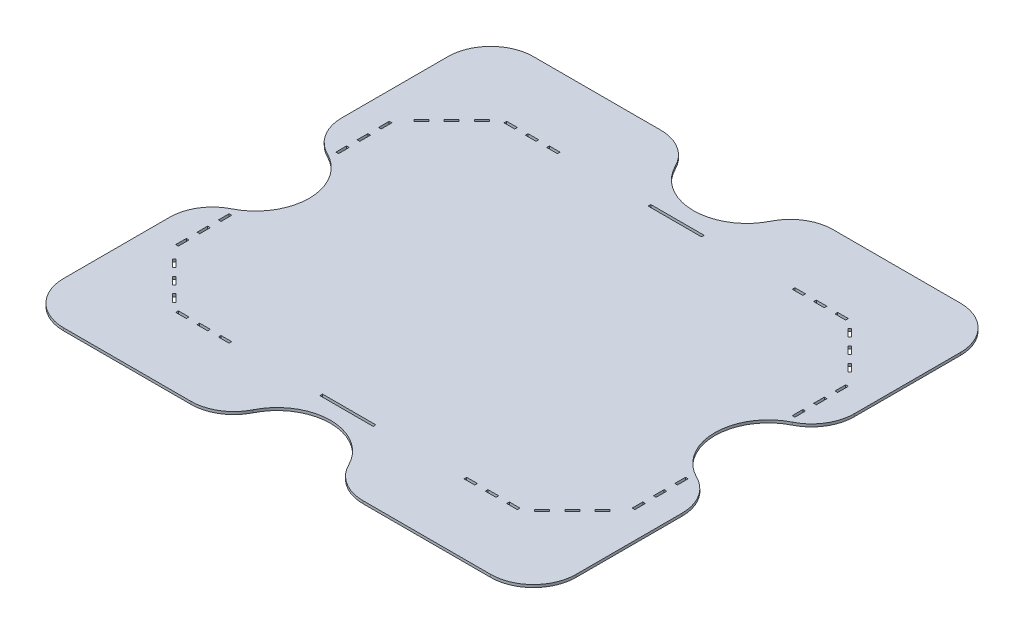
from build123d import *

# Parameters (mm, degrees)
BOSS_EXTRUDE1_DEPTH     = 3.175
FILLET1_R               = 50.8
SKETCH2_W               = 12.7
SKETCH2_H               = 3.175
CUT_EXTRUDE1_DEPTH      = 3.175
MIRROR2_COPY_1_SKETCH_W = 12.7
MIRROR2_COPY_1_SKETCH_H = 3.175
MIRROR2_COPY_1_DEPTH    = 3.175
CUT_EXTRUDE2_DEPTH      = 3.175
SKETCH4_W               = 63.5
SKETCH4_H               = 3.175
CUT_EXTRUDE3_DEPTH      = 3.175
MIRROR5_COPY_1_DEPTH    = 3.175
MIRROR5_COPY_2_DEPTH    = 3.175
SKETCH5_W               = 3.175
SKETCH5_H               = 12.7
CUT_EXTRUDE4_DEPTH      = 3.175
MIRROR7_COPY_1_SKETCH_W = 3.175
MIRROR7_COPY_1_SKETCH_H = 12.7
MIRROR7_COPY_1_DEPTH    = 3.175


with BuildPart() as part:
    # Sketch1 → Boss-Extrude1 (new body)
    with BuildSketch(Plane(origin=(0, 0, 0), x_dir=(1, 0, 0), z_dir=(0, 1, 0))):
        with BuildLine():
            ThreePointArc((-304.8, -228.6), (-289.921024484, -264.521024484), (-254, -279.4))
            Line((-254, -279.4), (-63.5, -279.4))
            ThreePointArc((-63.5, -279.4), (0, -215.9), (63.5, -279.4))
            Line((63.5, -279.4), (254, -279.4))
            ThreePointArc((254, -279.4), (289.921024484, -264.521024484), (304.8, -228.6))
            Line((304.8, -228.6), (304.8, -63.5))
            ThreePointArc((304.8, -63.5), (241.3, 0), (304.8, 63.5))
            Line((304.8, 63.5), (304.8, 228.6))
            ThreePointArc((304.8, 228.6), (289.921024484, 264.521024484), (254, 279.4))
            Line((254, 279.4), (63.5, 279.4))
            ThreePointArc((63.5, 279.4), (0, 215.9), (-63.5, 279.4))
            Line((-63.5, 279.4), (-254, 279.4))
            ThreePointArc((-254, 279.4), (-289.921024484, 264.521024484), (-304.8, 228.6))
            Line((-304.8, 228.6), (-304.8, 63.5))
            ThreePointArc((-304.8, 63.5), (-241.3, 0), (-304.8, -63.5))
            Line((-304.8, -63.5), (-304.8, -228.6))
        make_face()
    extrude(amount=BOSS_EXTRUDE1_DEPTH)

    # Fillet1
    fillet1_edges = [part.edges().sort_by_distance(p)[0] for p in [
        (-63.5, 1.5875, -279.4),
        (63.5, 1.5875, -279.4),
        (304.8, 1.5875, -63.5),
        (304.8, 1.5875, 63.5),
        (63.5, 1.5875, 279.4),
        (-63.5, 1.5875, 279.4),
        (-304.8, 1.5875, 63.5),
        (-304.8, 1.5875, -63.5),
    ]]
    fillet(fillet1_edges, radius=FILLET1_R)

    # Sketch2 → Cut-Extrude1 (cut)
    with BuildSketch(Plane(origin=(0, 3.175, 0), x_dir=(1, 0, 0), z_dir=(0, 1, 0))):
        with Locations((-171.45, 195.2625)):
            Rectangle(SKETCH2_W, SKETCH2_H)
        with Locations((-196.85, 195.2625)):
            Rectangle(SKETCH2_W, SKETCH2_H)
        with Locations((-146.05, 195.2625)):
            Rectangle(SKETCH2_W, SKETCH2_H)
    cut_extrude1 = extrude(amount=-CUT_EXTRUDE1_DEPTH, mode=Mode.SUBTRACT)

    # Mirror1: Cut-Extrude1 across plane
    add(cut_extrude1.mirror(Plane.XY), mode=Mode.SUBTRACT)

    # Mirror2: Cut-Extrude1 across plane
    add(cut_extrude1.mirror(Plane(origin=(0, 0, 0), x_dir=(0, 0, 1), z_dir=(1, 0, 0))), mode=Mode.SUBTRACT)

    # Mirror2 copy 1 sketch → Mirror2 copy 1 (cut)
    with BuildSketch(Plane(origin=(0, 3.175, 0), x_dir=(-1, 0, 0), z_dir=(0, 1, 0))):
        with Locations((-171.45, 195.2625)):
            Rectangle(MIRROR2_COPY_1_SKETCH_W, MIRROR2_COPY_1_SKETCH_H)
        with Locations((-196.85, 195.2625)):
            Rectangle(MIRROR2_COPY_1_SKETCH_W, MIRROR2_COPY_1_SKETCH_H)
        with Locations((-146.05, 195.2625)):
            Rectangle(MIRROR2_COPY_1_SKETCH_W, MIRROR2_COPY_1_SKETCH_H)
    extrude(amount=-MIRROR2_COPY_1_DEPTH, mode=Mode.SUBTRACT)

    # Sketch3 → Cut-Extrude2 (cut)
    with BuildSketch(Plane(origin=(0, 3.175, 0), x_dir=(1, 0, 0), z_dir=(0, 1, 0))):
        Polygon((-251.369743879, 152.653015062), (-260.35, 143.672758941), (-258.10493597, 141.42769491), (-249.124679849, 150.407951031), align=None)
        Polygon((-233.409231637, 170.613527304), (-242.389487758, 161.633271183), (-240.144423728, 159.388207153), (-231.164167607, 168.368463274), align=None)
        Polygon((-213.203655364, 186.328975516), (-222.183911485, 177.348719395), (-224.428975516, 179.593783425), (-215.448719395, 188.574039546), align=None)
    cut_extrude2 = extrude(amount=-CUT_EXTRUDE2_DEPTH, mode=Mode.SUBTRACT)

    # Sketch4 → Cut-Extrude3 (cut)
    with BuildSketch(Plane(origin=(0, 3.175, 0), x_dir=(1, 0, 0), z_dir=(0, 1, 0))):
        with Locations((0, 195.2625)):
            Rectangle(SKETCH4_W, SKETCH4_H)
        with Locations((0, -195.2625)):
            Rectangle(SKETCH4_W, SKETCH4_H)
    cut_extrude3 = extrude(amount=-CUT_EXTRUDE3_DEPTH, mode=Mode.SUBTRACT)

    # Mirror4: Cut-Extrude2 across plane
    add(cut_extrude2.mirror(Plane.XY), mode=Mode.SUBTRACT)

    # Mirror5: Cut-Extrude3 across plane
    add(cut_extrude3.mirror(Plane(origin=(0, 0, 0), x_dir=(0, 0, 1), z_dir=(1, 0, 0))), mode=Mode.SUBTRACT)

    # Mirror5 copy 1 sketch → Mirror5 copy 1 (cut)
    with BuildSketch(Plane(origin=(0, 3.175, 0), x_dir=(-1, 0, 0), z_dir=(0, 1, 0))):
        Polygon((-251.369743879, 152.653015062), (-260.35, 143.672758941), (-258.10493597, 141.42769491), (-249.124679849, 150.407951031), align=None)
        Polygon((-233.409231637, 170.613527304), (-242.389487758, 161.633271183), (-240.144423728, 159.388207153), (-231.164167607, 168.368463274), align=None)
        Polygon((-213.203655364, 186.328975516), (-222.183911485, 177.348719395), (-224.428975516, 179.593783425), (-215.448719395, 188.574039546), align=None)
    extrude(amount=-MIRROR5_COPY_1_DEPTH, mode=Mode.SUBTRACT)

    # Mirror5 copy 2 sketch → Mirror5 copy 2 (cut)
    with BuildSketch(Plane(origin=(0, 3.175, 0), x_dir=(-1, 0, 0), z_dir=(0, 1, 0))):
        Polygon((-251.369743879, -152.653015062), (-260.35, -143.672758941), (-258.10493597, -141.42769491), (-249.124679849, -150.407951031), align=None)
        Polygon((-233.409231637, -170.613527304), (-242.389487758, -161.633271183), (-240.144423728, -159.388207153), (-231.164167607, -168.368463274), align=None)
        Polygon((-213.203655364, -186.328975516), (-222.183911485, -177.348719395), (-224.428975516, -179.593783425), (-215.448719395, -188.574039546), align=None)
    extrude(amount=-MIRROR5_COPY_2_DEPTH, mode=Mode.SUBTRACT)

    # Sketch5 → Cut-Extrude4 (cut)
    with BuildSketch(Plane(origin=(0, 3.175, 0), x_dir=(1, 0, 0), z_dir=(0, 1, 0))):
        with Locations((-271.4625, -95.25)):
            Rectangle(SKETCH5_W, SKETCH5_H)
        with Locations((-271.4625, -69.85)):
            Rectangle(SKETCH5_W, SKETCH5_H)
        with Locations((-271.4625, -120.65)):
            Rectangle(SKETCH5_W, SKETCH5_H)
    cut_extrude4 = extrude(amount=-CUT_EXTRUDE4_DEPTH, mode=Mode.SUBTRACT)

    # Mirror6: Cut-Extrude4 across plane
    add(cut_extrude4.mirror(Plane(origin=(0, 0, 0), x_dir=(0, 0, 1), z_dir=(1, 0, 0))), mode=Mode.SUBTRACT)

    # Mirror7: Cut-Extrude4 across plane
    add(cut_extrude4.mirror(Plane.XY), mode=Mode.SUBTRACT)

    # Mirror7 copy 1 sketch → Mirror7 copy 1 (cut)
    with BuildSketch(Plane(origin=(0, 3.175, 0), x_dir=(-1, 0, 0), z_dir=(0, 1, 0))):
        with Locations((-271.4625, -95.25)):
            Rectangle(MIRROR7_COPY_1_SKETCH_W, MIRROR7_COPY_1_SKETCH_H)
        with Locations((-271.4625, -69.85)):
            Rectangle(MIRROR7_COPY_1_SKETCH_W, MIRROR7_COPY_1_SKETCH_H)
        with Locations((-271.4625, -120.65)):
            Rectangle(MIRROR7_COPY_1_SKETCH_W, MIRROR7_COPY_1_SKETCH_H)
    extrude(amount=-MIRROR7_COPY_1_DEPTH, mode=Mode.SUBTRACT)


solid = part.part
